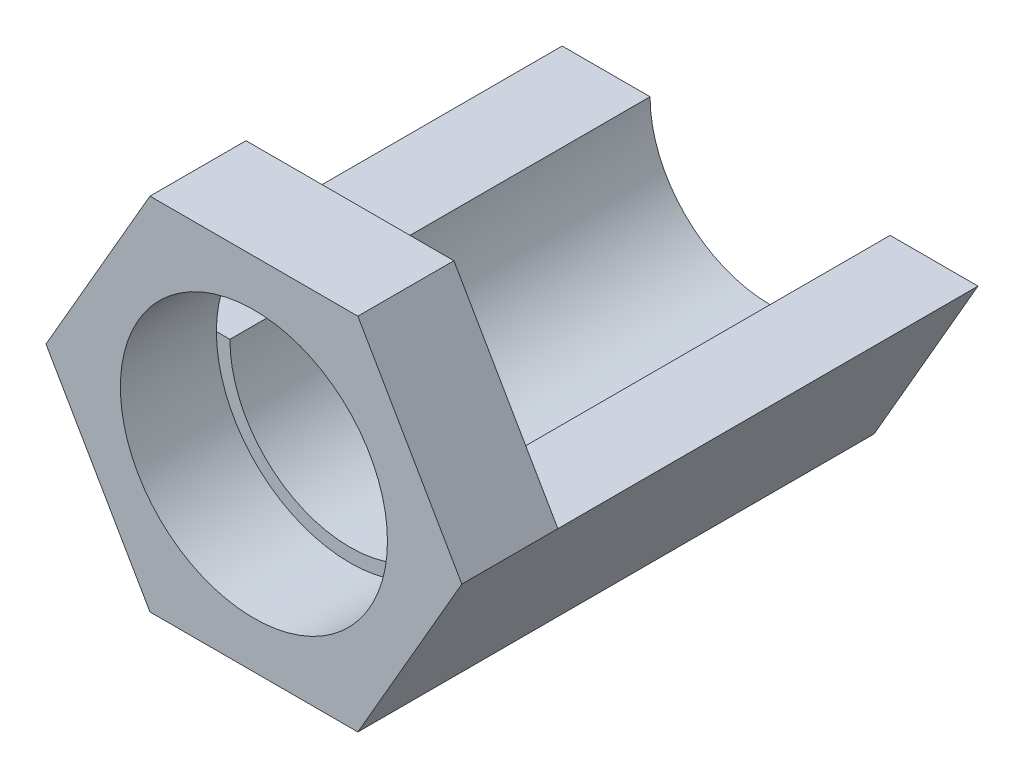
from build123d import *

# Parameters (mm, degrees)
SKETCH1_R           = 11.125
BOSS_EXTRUDE1_DEPTH = 8
BOSS_EXTRUDE2_DEPTH = 35


with BuildPart() as part:
    # Sketch1 → Boss-Extrude1 (new body)
    with BuildSketch(Plane.XY):
        Polygon((17.320508076, 0), (8.660254038, 15), (-8.660254038, 15), (-17.320508076, 0), (-8.660254038, -15), (8.660254038, -15), align=None)
        Circle(SKETCH1_R, mode=Mode.SUBTRACT)
    extrude(amount=-BOSS_EXTRUDE1_DEPTH)

    # Sketch2 → Boss-Extrude2 (add)
    with BuildSketch(Plane(origin=(0, 0, -8), x_dir=(-1, 0, 0), z_dir=(0, 0, -1))):
        with BuildLine():
            Line((-17.320508076, 0), (-10, 0))
            ThreePointArc((-10, 0), (0, -10), (10, 0))
            Line((10, 0), (17.320508076, 0))
            Line((17.320508076, 0), (8.660254038, -15))
            Line((8.660254038, -15), (-8.660254038, -15))
            Line((-8.660254038, -15), (-17.320508076, 0))
        make_face()
    extrude(amount=BOSS_EXTRUDE2_DEPTH)


solid = part.part
